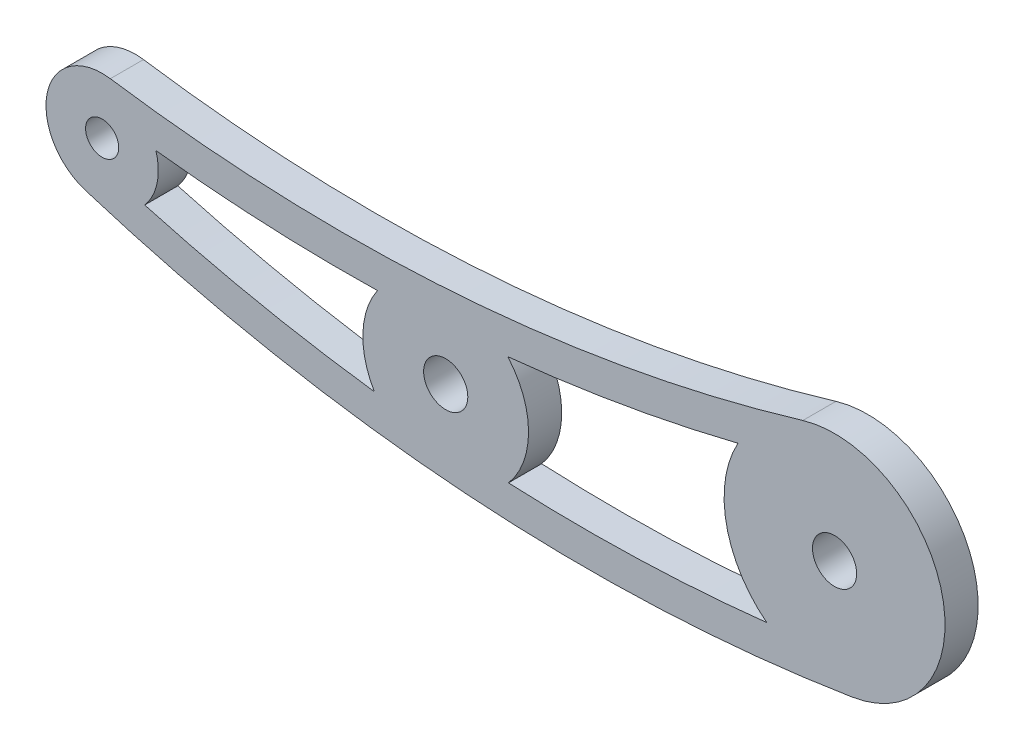
from build123d import *

# Parameters (mm, degrees)
SKETCH1_R           = 1.5
SKETCH1_R_2         = 2
EXTRUDE1_DEPTH      = 3
BOSS_EXTRUDE1_START = -3
BOSS_EXTRUDE1_DEPTH = 3
CUT_EXTRUDE1_START  = -5
SKETCH3_R           = 2
CUT_EXTRUDE1_DEPTH  = 5


with BuildPart() as part:
    # Sketch1 → Extrude1 (new body)
    with BuildSketch(Plane.XY):
        with BuildLine():
            ThreePointArc((-2.193092226, -4.586072393), (33.15, -8), (68.493092226, -4.586072393))
            ThreePointArc((68.493092226, -4.586072393), (71.132119564, 1.578712775), (65.362424897, 4.996265248))
            ThreePointArc((65.362424897, 4.996265248), (33.150000007, 2), (0.937575117, 4.996265246))
            ThreePointArc((0.937575117, 4.996265246), (-4.832119562, 1.578712782), (-2.193092226, -4.586072393))
        make_face()
        with Locations((31.1, -3.74)):
            Circle(SKETCH1_R, mode=Mode.SUBTRACT)
        Circle(SKETCH1_R, mode=Mode.SUBTRACT)
        with Locations((66.3, 0)):
            Circle(SKETCH1_R_2, mode=Mode.SUBTRACT)
    extrude(amount=EXTRUDE1_DEPTH)

    # Sketch2 → Boss-Extrude1 (add)
    with BuildSketch(Plane.XY.offset(3).offset(BOSS_EXTRUDE1_START)):
        with BuildLine():
            ThreePointArc((-1.523614168, -4.849774569), (32.891650058, -11.40834478), (67.892593326, -9.872367826))
            ThreePointArc((67.892593326, -9.872367826), (76.046454518, 2.23754873), (63.427158085, 9.578453911))
            ThreePointArc((63.427158085, 9.578453911), (32.334608499, 3.858874967), (0.742030741, 5.029026137))
            ThreePointArc((0.742030741, 5.029026137), (0.839962665, 5.013599129), (0.937575117, 4.996265246))
            ThreePointArc((0.937575117, 4.996265246), (33.150000007, 2), (65.362424897, 4.996265248))
            ThreePointArc((65.362424897, 4.996265248), (71.132119564, 1.578712775), (68.493092226, -4.586072393))
            ThreePointArc((68.493092226, -4.586072393), (33.15, -8), (-2.193092226, -4.586072393))
            ThreePointArc((-2.193092226, -4.586072393), (-1.863024775, -4.729783525), (-1.523614168, -4.849774569))
        make_face()
    extrude(amount=BOSS_EXTRUDE1_DEPTH)

    # Sketch3 → Cut-Extrude1 (cut)
    with BuildSketch(Plane.XY.offset(3).offset(CUT_EXTRUDE1_START)):
        with Locations((66.3, 0)):
            Circle(SKETCH3_R)
        with Locations((31.1, -3.74)):
            Circle(SKETCH3_R)
        with BuildLine():
            ThreePointArc((3.852185168, -3.316984011), (4.972034413, -1.058577959), (4.86926369, 1.460131712))
            ThreePointArc((4.86926369, 1.460131712), (14.879037339, 0.644485923), (24.921100593, 0.511023655))
            ThreePointArc((24.921100593, 0.511023655), (23.604378321, -3.483766436), (24.645226339, -7.559148726))
            ThreePointArc((24.645226339, -7.559148726), (14.172697484, -5.810622174), (3.852185168, -3.316984011))
        make_face()
        with BuildLine():
            ThreePointArc((57.559699529, 4.858718728), (56.502324822, -2.001389793), (60.165384794, -7.897246119))
            ThreePointArc((60.165384794, -7.897246119), (48.487966367, -8.728733859), (36.781348534, -8.636149389))
            ThreePointArc((36.781348534, -8.636149389), (38.599846278, -3.691981225), (36.718188813, 1.228496198))
            ThreePointArc((36.718188813, 1.228496198), (47.20402982, 2.669943525), (57.559699529, 4.858718728))
        make_face()
    extrude(amount=CUT_EXTRUDE1_DEPTH, mode=Mode.SUBTRACT)


solid = part.part
